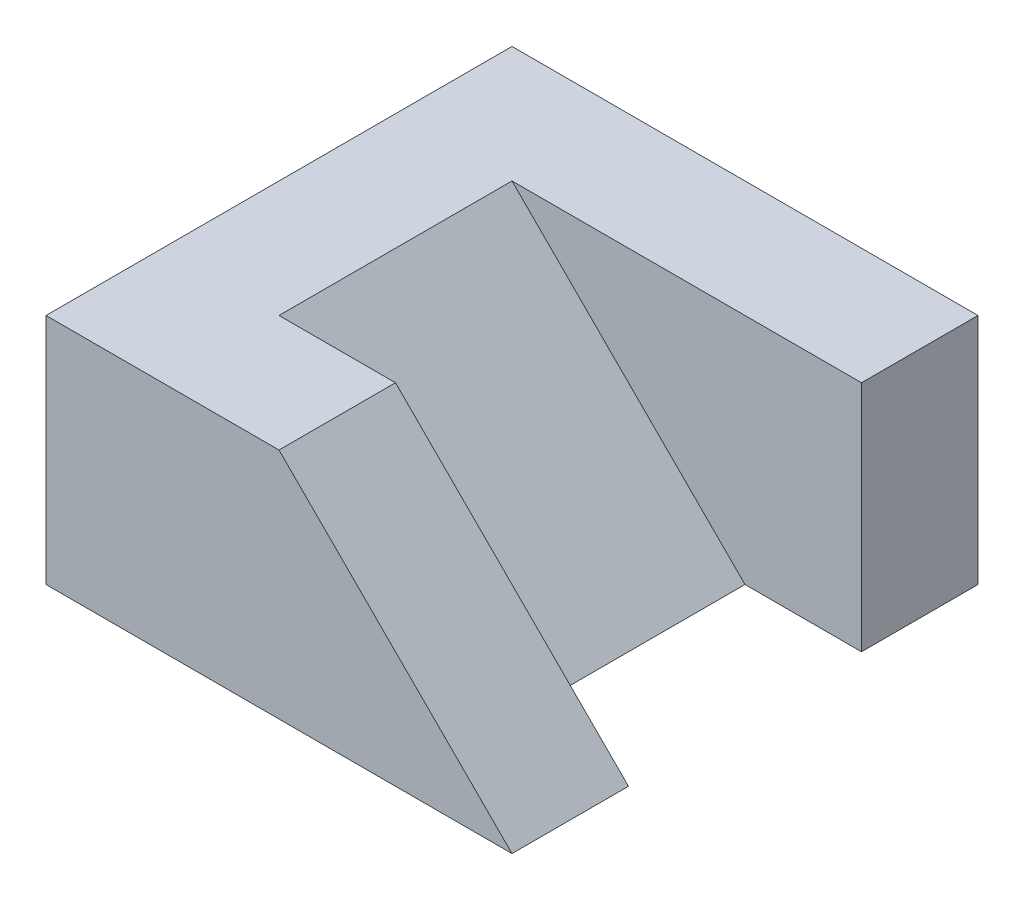
from build123d import *

# Parameters (mm, degrees)
BOSS_EXTRUDE1_DEPTH = 20
CUT_EXTRUDE1_DEPTH  = 20
BOSS_EXTRUDE2_DEPTH = 10


with BuildPart() as part:
    # Sketch1 → Boss-Extrude1 (new body)
    with BuildSketch(Plane(origin=(0, 0, 0), x_dir=(1, 0, 0), z_dir=(0, 1, 0))):
        Polygon((-9.756097561, 6.585365854), (-9.756097561, 16.585365854), (-49.756097561, 16.585365854), (-49.756097561, -13.414634146), (-39.756097561, -13.414634146), (-19.756097561, -13.414634146), (-19.756097561, 6.585365854), align=None)
    extrude(amount=BOSS_EXTRUDE1_DEPTH)

    # Sketch2 → Cut-Extrude1 (cut)
    with BuildSketch(Plane.XY.offset(13.414634146)):
        Polygon((-19.756097561, 0), (-39.756097561, 20), (-19.756097561, 20), align=None)
    extrude(amount=-CUT_EXTRUDE1_DEPTH, mode=Mode.SUBTRACT)

    # Sketch3 → Boss-Extrude2 (add)
    with BuildSketch(Plane.XY.offset(13.414634146)):
        Polygon((-49.756097561, 20), (-49.756097561, 0), (-9.756097561, 0), (-29.756097561, 20), align=None)
    extrude(amount=BOSS_EXTRUDE2_DEPTH)


solid = part.part
